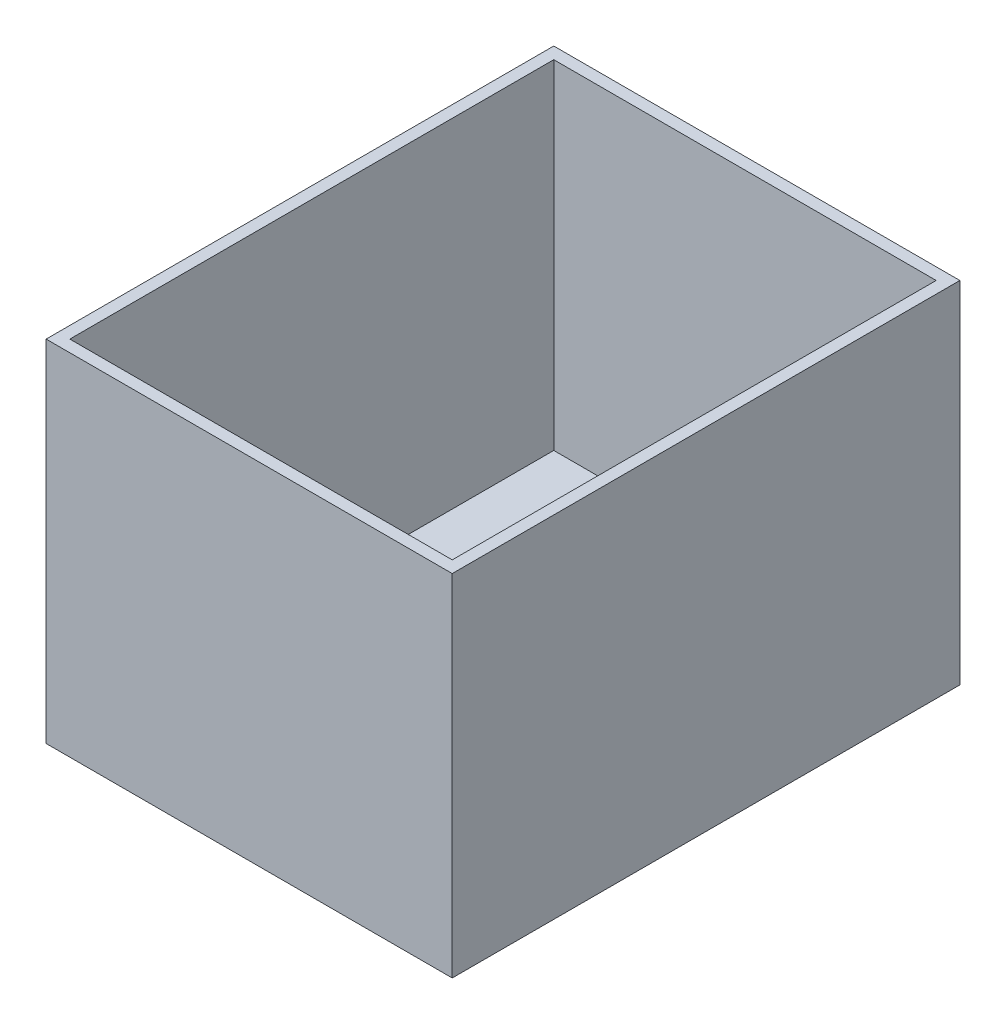
from build123d import *

# Parameters (mm, degrees)
SKETCH1_W           = 120
SKETCH1_H           = 150
BOSS_EXTRUDE1_DEPTH = 3.5
SKETCH2_W           = 120
SKETCH2_H           = 150
SKETCH2_W_2         = 113
SKETCH2_H_2         = 143
BOSS_EXTRUDE3_DEPTH = 100


with BuildPart() as part:
    # Sketch1 → Boss-Extrude1 (new body)
    with BuildSketch(Plane(origin=(0, 0, 0), x_dir=(1, 0, 0), z_dir=(0, 1, 0))):
        with Locations((-60, 75)):
            Rectangle(SKETCH1_W, SKETCH1_H)
    extrude(amount=BOSS_EXTRUDE1_DEPTH)

    # Sketch2 → Boss-Extrude3 (add)
    with BuildSketch(Plane(origin=(0, 3.5, 0), x_dir=(1, 0, 0), z_dir=(0, 1, 0))):
        with Locations((-60, 75)):
            Rectangle(SKETCH2_W, SKETCH2_H)
        with Locations((-60, 75)):
            Rectangle(SKETCH2_W_2, SKETCH2_H_2, mode=Mode.SUBTRACT)
    extrude(amount=BOSS_EXTRUDE3_DEPTH)


solid = part.part
